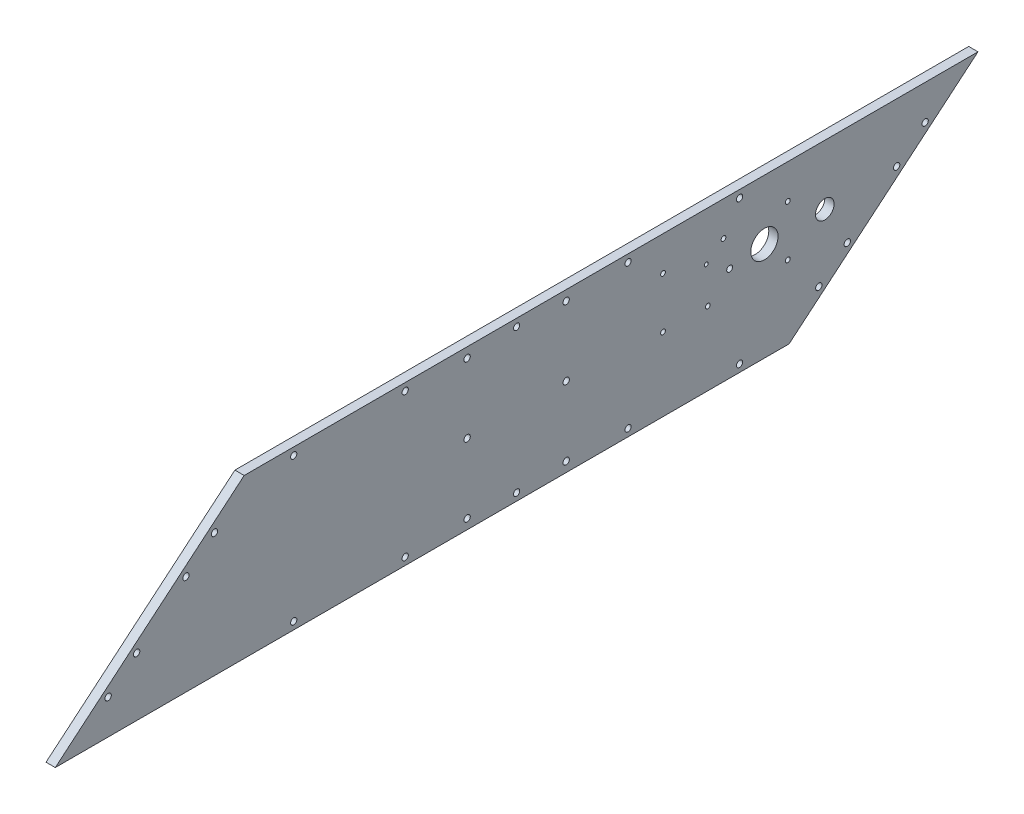
from build123d import *

# Parameters (mm, degrees)
BOSS_EXTRUDE1_DEPTH           = 4.7625
SKETCH2_R                     = 6.9977
SKETCH2_R_2                   = 1.4986
SKETCH2_R_3                   = 0.9906
SKETCH2_R_4                   = 4.7625
GEARBOX_WITH_PRESS_FITS_DEPTH = 412.602247496
SKETCH6_R                     = 1.59385
CUT_EXTRUDE2_DEPTH            = 412.602247496
F_4_CLEARANCE_HOLE2_D         = 3.2639
F_2_CLEARANCE_HOLE1_D         = 2.4384
F_2_CLEARANCE_HOLE1_DEPTH     = 4.826
F_2_CLEARANCE_HOLE1_TIP       = 0.732569267
F_4_CLEARANCE_HOLE1_D         = 3.2639
F_4_CLEARANCE_HOLE1_DEPTH     = 4.826
F_4_CLEARANCE_HOLE1_TIP       = 0.980574487


with BuildPart() as part:
    # Sketch1 → Boss-Extrude1 (new body)
    with BuildSketch(Plane(origin=(0, 0, 0), x_dir=(0, 0, -1), z_dir=(1, 0, 0))):
        Polygon((33.297595377, -40.64), (312.697595377, -40.64), (345.995190754, -12.7), (409.563327383, 40.64), (312.697595377, 40.64), (33.297595377, 40.64), (0, 12.7), (-63.568136629, -40.64), align=None)
    extrude(amount=BOSS_EXTRUDE1_DEPTH)

    # Sketch2 → Gearbox (with Press fits) (cut, through all)
    with BuildSketch(Plane(origin=(4.7625, 0, 0), x_dir=(0, 0, -1), z_dir=(1, 0, 0))):
        with Locations((300.047997426, 10)):
            Circle(SKETCH2_R)
        with Locations((282.214696722, 8)):
            Circle(SKETCH2_R_2)
        with Locations((270.217776392, 15.933400182)):
            Circle(SKETCH2_R_3)
        with Locations((331.004197426, 10)):
            Circle(SKETCH2_R_4)
    extrude(amount=-GEARBOX_WITH_PRESS_FITS_DEPTH, mode=Mode.SUBTRACT)

    # Sketch6 → Cut-Extrude2 (cut, through all)
    with BuildSketch(Plane(origin=(4.7625, 0, 0), x_dir=(0, 0, -1), z_dir=(1, 0, 0))):
        with Locations((287.297595377, 36.83)):
            Circle(SKETCH6_R)
        with Locations((230.147595377, 36.83)):
            Circle(SKETCH6_R)
        with Locations((172.997595377, 36.83)):
            Circle(SKETCH6_R)
        with Locations((115.847595377, 36.83)):
            Circle(SKETCH6_R)
        with Locations((58.697595377, 36.83)):
            Circle(SKETCH6_R)
        with Locations((58.697595377, -36.83)):
            Circle(SKETCH6_R)
        with Locations((115.847595377, -36.83)):
            Circle(SKETCH6_R)
        with Locations((172.997595377, -36.83)):
            Circle(SKETCH6_R)
        with Locations((230.147595377, -36.83)):
            Circle(SKETCH6_R)
        with Locations((287.297595377, -36.83)):
            Circle(SKETCH6_R)
    extrude(amount=-CUT_EXTRUDE2_DEPTH, mode=Mode.SUBTRACT)

    # #4 Clearance Hole2 (through all)
    with Locations(Plane(origin=(4.7625, 0, 0), x_dir=(0, 0, -1), z_dir=(1, 0, 0))):
        with Locations((147.597595377, 35.56), (198.397595377, 35.56), (198.397595377, -35.56), (147.597595377, -35.56), (147.597595377, 0), (198.397595377, 0)):
            Hole(F_4_CLEARANCE_HOLE2_D / 2)

    # #2 Clearance Hole1
    with Locations(Plane(origin=(4.7625, 0, 0), x_dir=(0, 0, -1), z_dir=(1, 0, 0))):
        with Locations((248.047997486, -3), (248.047997486, 23), (271.047997556, -3), (312.047997486, -3), (279.047997486, 23), (312.047997486, 23)):
            Hole(F_2_CLEARANCE_HOLE1_D / 2, depth=F_2_CLEARANCE_HOLE1_DEPTH)
            with Locations((0, 0, -(F_2_CLEARANCE_HOLE1_DEPTH + F_2_CLEARANCE_HOLE1_TIP / 2))):  # 118° drill point
                Cone(0, F_2_CLEARANCE_HOLE1_D / 2, F_2_CLEARANCE_HOLE1_TIP, mode=Mode.SUBTRACT)

    # #4 Clearance Hole1
    with Locations(Plane(origin=(4.7625, 0, 0), x_dir=(0, 0, -1), z_dir=(1, 0, 0))):
        with Locations((327.962613202, -22.8575274), (342.555759844, -10.612423436), (367.850547356, 10.612423436), (382.443693997, 22.8575274), (-36.448503243, -22.8575274), (-21.855356602, -10.612423436), (3.43943091, 10.612423436), (18.032577552, 22.8575274)):
            Hole(F_4_CLEARANCE_HOLE1_D / 2, depth=F_4_CLEARANCE_HOLE1_DEPTH)
            with Locations((0, 0, -(F_4_CLEARANCE_HOLE1_DEPTH + F_4_CLEARANCE_HOLE1_TIP / 2))):  # 118° drill point
                Cone(0, F_4_CLEARANCE_HOLE1_D / 2, F_4_CLEARANCE_HOLE1_TIP, mode=Mode.SUBTRACT)


solid = part.part
